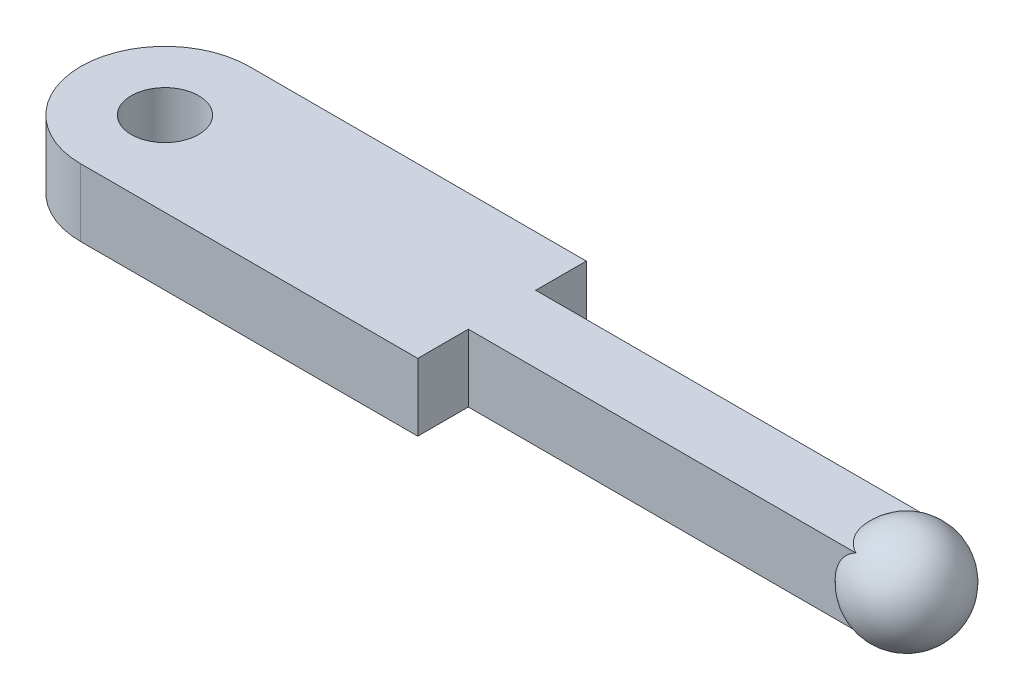
from build123d import *

# Parameters (mm, degrees)
SKETCH1_R           = 1
BOSS_EXTRUDE1_DEPTH = 2
SKETCH4_W           = 2
SKETCH4_H           = 2
BOSS_EXTRUDE2_DEPTH = 12


with BuildPart() as part:
    # Sketch1 → Boss-Extrude1 (new body)
    with BuildSketch(Plane(origin=(0, 0, 0), x_dir=(1, 0, 0), z_dir=(0, 1, 0))):
        with BuildLine():
            Line((-10, 2.5), (0, 2.5))
            Line((0, 2.5), (0, -2.5))
            Line((0, -2.5), (-10, -2.5))
            ThreePointArc((-10, -2.5), (-12.5, 0), (-10, 2.5))
        make_face()
        with Locations(Location((-10, 0, 0), (0, 0, 270))):
            Circle(SKETCH1_R, mode=Mode.SUBTRACT)
    extrude(amount=BOSS_EXTRUDE1_DEPTH)

    # Sketch4 → Boss-Extrude2 (add)
    with BuildSketch(Plane(origin=(0, 0, 0), x_dir=(0, 0, -1), z_dir=(1, 0, 0))):
        with Locations((0, 1)):
            Rectangle(SKETCH4_W, SKETCH4_H)
    extrude(amount=BOSS_EXTRUDE2_DEPTH)

    # Sketch5 → Revolve1 (revolve)
    with BuildSketch(Plane.XY):
        with BuildLine():
            Line((10.614180701, 1.574025149), (12, 1))
            Line((12, 1), (13.5, 1))
            ThreePointArc((13.5, 1), (12.292635483, 2.471177921), (10.614180701, 1.574025149))
        make_face()
    revolve(axis=Axis((0.012505213, 1, 0), (1, 0, 0)))


solid = part.part
